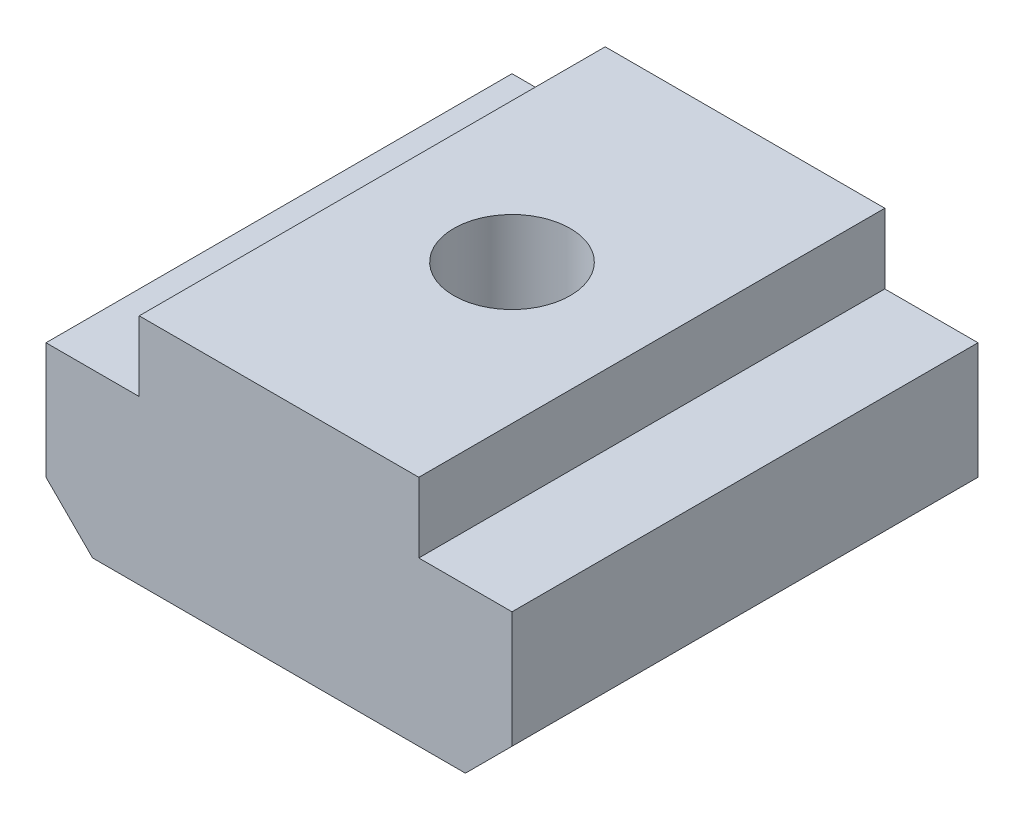
from build123d import *

# Parameters (mm, degrees)
BOSS_EXTRUDE1_DEPTH   = 10
M3X0_5_TAPPED_HOLE1_D = 2.5


with BuildPart() as part:
    # Sketch1 → Boss-Extrude1 (new body)
    with BuildSketch(Plane.XY):
        Polygon((-4, 0), (4, 0), (5, 1), (5, 3.5), (3, 3.5), (3, 5), (-3, 5), (-3, 3.5), (-5, 3.5), (-5, 1), align=None)
    extrude(amount=BOSS_EXTRUDE1_DEPTH)

    # M3x0.5 Tapped Hole1 (through all)
    with Locations(Plane(origin=(0, 5, 0), x_dir=(1, 0, 0), z_dir=(0, 1, 0))):
        with Locations((0, -5)):
            Hole(M3X0_5_TAPPED_HOLE1_D / 2)


solid = part.part
